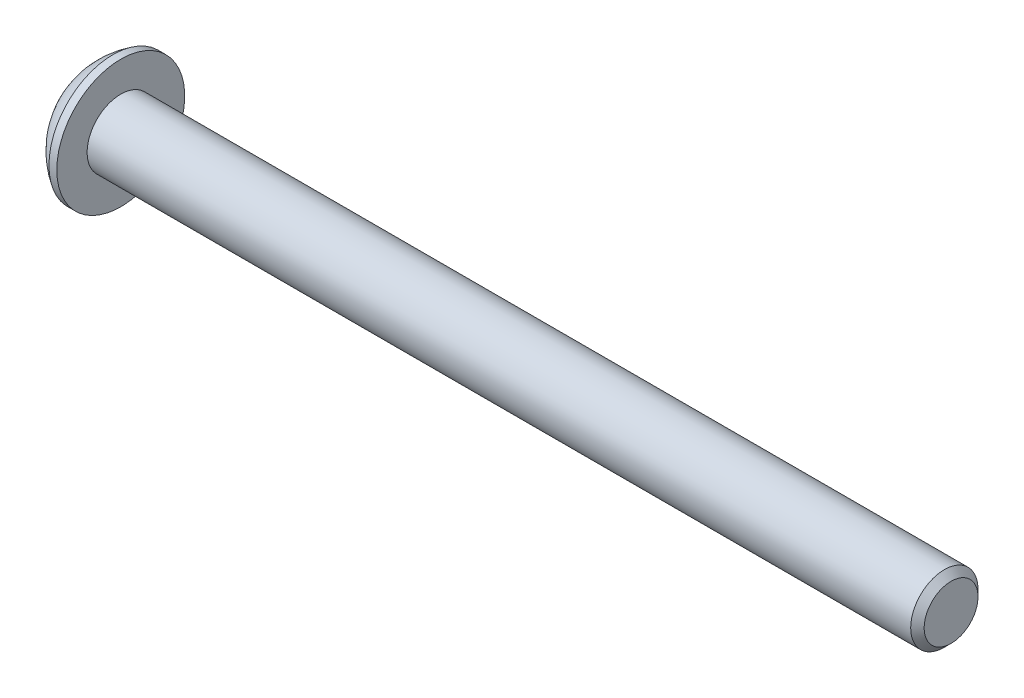
from build123d import *

# Parameters (mm, degrees)
CHAMFER1_SIZE      = 0.3
CUT_EXTRUDE1_DEPTH = 1


with BuildPart() as part:
    # Sketch1 → Revolve1 (revolve)
    with BuildSketch(Plane.XY, mode=Mode.PRIVATE) as revolve1_sk:
        with BuildLine():
            Line((0, 0), (38.65, 0))
            Line((38.65, 0), (38.65, 1.5))
            Line((38.65, 1.5), (1.65, 1.5))
            Line((1.65, 1.5), (1.65, 2.85))
            Line((1.65, 2.85), (1.3, 2.85))
            ThreePointArc((1.3, 2.85), (0.550445176, 2.231141741), (0, 1.43))
            Line((0, 1.43), (0, 0))
        make_face()
    revolve(revolve1_sk.sketch.rotate(Axis((0, 0, 0), (1, 0, 0)), 90), axis=Axis((0, 0, 0), (1, 0, 0)))

    # Chamfer1
    chamfer1_edges = [part.edges().sort_by_distance(p)[0] for p in [
        (38.65, 0, -1.5),
    ]]
    chamfer(chamfer1_edges, length=CHAMFER1_SIZE)

    # Sketch2 → Cut-Extrude1 (cut)
    with BuildSketch(Plane.ZY):
        Polygon((0, 1.154700538), (-1, 0.577350269), (-1, -0.577350269), (0, -1.154700538), (1, -0.577350269), (1, 0.577350269), align=None)
    extrude(amount=-CUT_EXTRUDE1_DEPTH, mode=Mode.SUBTRACT)


solid = part.part
